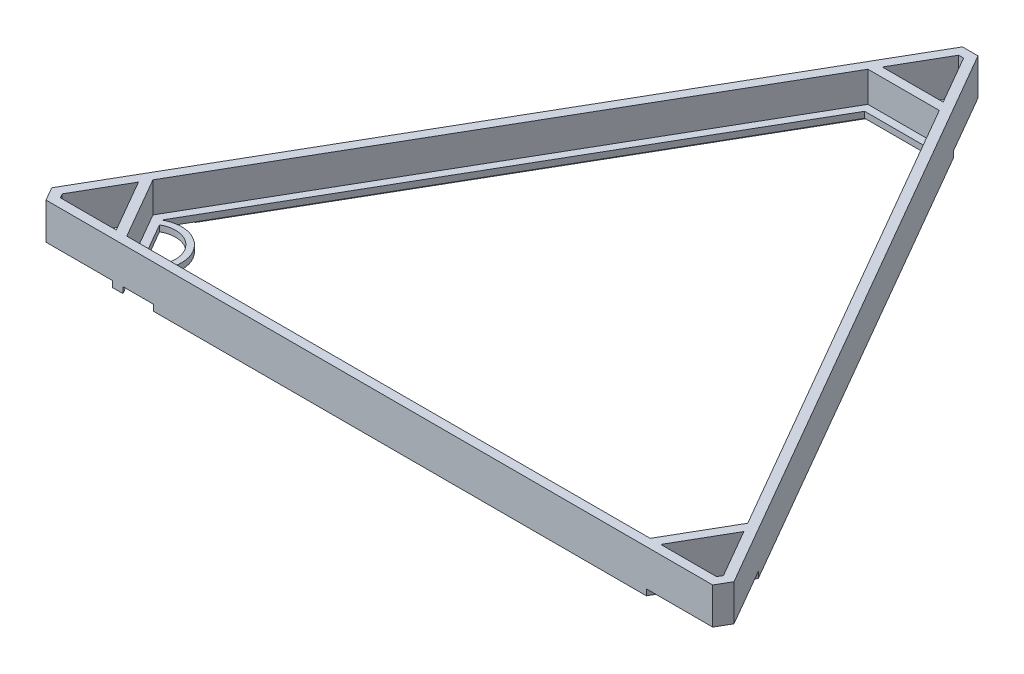
from build123d import *

# Parameters (mm, degrees)
BOSS_EXTRUDE1_DEPTH = 12
BOSS_EXTRUDE2_DEPTH = 2
BOSS_EXTRUDE3_DEPTH = 2


with BuildPart() as part:
    # Sketch1 → Boss-Extrude1 (new body)
    with BuildSketch(Plane(origin=(0, 0, 0), x_dir=(1, 0, 0), z_dir=(0, 1, 0))):
        Polygon((109.556624327, -4.42820323), (-109.556624327, -4.42820323), (-112.113248654, 0), (-2.556624327, 189.75763964), (2.556624326, 189.75763964), (112.113248654, 0), align=None)
        Polygon((-107.82457352, -1.42820323), (-108.649147039, 0), (-99.473720558, 15.892304845), (-89.473720558, -1.42820323), align=None, mode=Mode.SUBTRACT)
        Polygon((-0.82457352, 186.75763964), (0.824573518, 186.75763964), (9.999999999, 170.865334794), (-10.000000001, 170.865334794), align=None, mode=Mode.SUBTRACT)
        Polygon((108.649147039, 0), (107.82457352, -1.42820323), (89.473720559, -1.42820323), (99.473720559, 15.892304846), align=None, mode=Mode.SUBTRACT)
        Polygon((-11.732050808, 167.865334795), (11.732050808, 167.865334795), (97.741669751, 18.892304846), (86.009618944, -1.42820323), (-86.009618943, -1.42820323), (-97.741669751, 18.892304845), align=None, mode=Mode.SUBTRACT)
    extrude(amount=BOSS_EXTRUDE1_DEPTH)

    # Sketch1<4> → Boss-Extrude2 (add)
    with BuildSketch(Plane(origin=(0, 0, 0), x_dir=(1, 0, 0), z_dir=(0, 1, 0))):
        Polygon((11.732050808, 167.865334795), (-11.732050808, 167.865334795), (-97.741669751, 18.892304845), (-86.009618943, -1.42820323), (86.009618944, -1.42820323), (97.741669751, 18.892304846), align=None)
        with BuildLine():
            Line((-85.56624327, 2.803847577), (-93.854918405, 17.160254038))
            ThreePointArc((-93.854918405, 17.160254038), (-82.532377607, 14.126388375), (-85.56624327, 2.803847577))
        make_face(mode=Mode.SUBTRACT)
        with BuildLine():
            Line((84.566243271, 1.07179677), (-84.56624327, 1.07179677))
            ThreePointArc((-84.56624327, 1.07179677), (-80.800326799, 15.126388375), (-94.854918405, 18.892304845))
            Line((-94.854918405, 18.892304845), (-10.288675135, 165.365334795))
            Line((-10.288675135, 165.365334795), (10.288675135, 165.365334795))
            Line((10.288675135, 165.365334795), (94.854918405, 18.892304846))
            Line((94.854918405, 18.892304846), (84.566243271, 1.07179677))
        make_face(mode=Mode.SUBTRACT)
    extrude(amount=BOSS_EXTRUDE2_DEPTH)

    # Sketch2 → Boss-Extrude3 (add)
    with BuildSketch(Plane.XZ):
        Polygon((-87.741669751, 4.42820323), (-101.205771366, -18.892304846), (-99.473720559, -21.892304845), (-84.277568136, 4.42820323), align=None)
        Polygon((87.741669751, 4.42820323), (-74.277568136, 4.42820323), (-76.009618943, 1.42820323), (86.009618943, 1.42820323), (97.74166975, -18.892304845), (11.732050807, -167.865334795), (-11.732050808, -167.865334795), (-92.741669751, -27.552558883), (-94.473720559, -30.552558883), (-13.464101616, -170.865334794), (13.464101615, -170.865334794), (101.205771366, -18.892304845), align=None)
    extrude(amount=BOSS_EXTRUDE3_DEPTH)


solid = part.part
